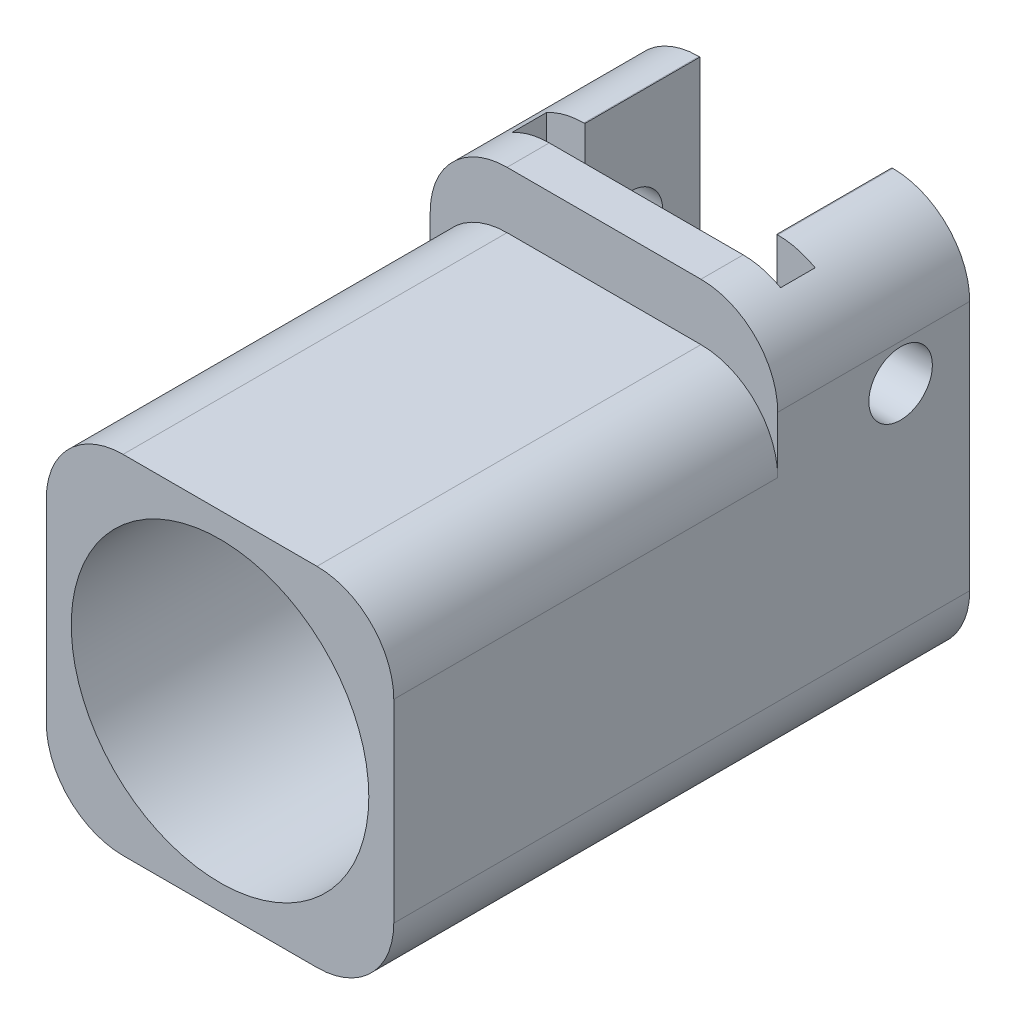
from build123d import *

# Parameters (mm, degrees)
BOSS_EXTRUDE1_DEPTH = 30
BOSS_EXTRUDE3_DEPTH = 10
SKETCH17_R          = 1.655
CUT_EXTRUDE10_DEPTH = 30
CUT_EXTRUDE11_DEPTH = 6
CUT_EXTRUDE12_DEPTH = 1.8
CUT_EXTRUDE13_DEPTH = 7.2
SKETCH24_R          = 7.75
CUT_EXTRUDE15_DEPTH = 19


with BuildPart() as part:
    # Sketch1 → Boss-Extrude1 (new body)
    with BuildSketch(Plane.XY):
        with BuildLine():
            Line((-5.05, 9.05), (5.05, 9.05))
            ThreePointArc((5.05, 9.05), (7.878427125, 7.878427125), (9.05, 5.05))
            Line((9.05, 5.05), (9.05, -5.05))
            ThreePointArc((9.05, -5.05), (7.878427125, -7.878427125), (5.05, -9.05))
            Line((5.05, -9.05), (-5.05, -9.05))
            ThreePointArc((-5.05, -9.05), (-7.878427125, -7.878427125), (-9.05, -5.05))
            Line((-9.05, -5.05), (-9.05, 5.05))
            ThreePointArc((-9.05, 5.05), (-7.878427125, 7.878427125), (-5.05, 9.05))
        make_face()
    extrude(amount=BOSS_EXTRUDE1_DEPTH)

    # Sketch15 → Boss-Extrude3 (add)
    with BuildSketch(Plane.XY):
        with BuildLine():
            Line((-5.05, -9.05), (5.05, -9.05))
            ThreePointArc((5.05, -9.05), (7.878427125, -7.878427125), (9.05, -5.05))
            Line((9.05, -5.05), (9.05, 8))
            ThreePointArc((9.05, 8), (7.878427125, 10.828427125), (5.05, 12))
            Line((5.05, 12), (-5.05, 12))
            ThreePointArc((-5.05, 12), (-7.878427125, 10.828427125), (-9.05, 8))
            Line((-9.05, 8), (-9.05, -5.05))
            ThreePointArc((-9.05, -5.05), (-7.878427125, -7.878427125), (-5.05, -9.05))
        make_face()
    extrude(amount=BOSS_EXTRUDE3_DEPTH)

    # Sketch17 → Cut-Extrude10 (cut)
    with BuildSketch(Plane(origin=(9.05, 0, 0), x_dir=(0, 0, -1), z_dir=(1, 0, 0))):
        with Locations((-3.6, 6.1)):
            Circle(SKETCH17_R)
    extrude(amount=-CUT_EXTRUDE10_DEPTH, mode=Mode.SUBTRACT)

    # Sketch18 → Cut-Extrude11 (cut)
    with BuildSketch(Plane.XY):
        Polygon((-4.996539756, -4.259182236), (-3.851088562, -6.946129507), (-2.048481088, -4.559068161), (-0.563070773, -7.21717083), (0.983895836, -4.624244345), (2.704822485, -7.21717083), (3.469678774, -4.870091009), (4.674482161, -7.026054964), (4.998172504, -5.668676456), (4.998172504, 5.373520003), (-4.996539756, 5.373520003), align=None)
    extrude(amount=CUT_EXTRUDE11_DEPTH, mode=Mode.SUBTRACT)

    # Sketch20 → Cut-Extrude12 (cut)
    with BuildSketch(Plane(origin=(0, 0, 6), x_dir=(-1, 0, 0), z_dir=(0, 0, -1))):
        Polygon((-7, 0), (-7, 13.473809321), (7, 13.473809321), (7, 0), (7, -7.194424303), (-7, -7.194424303), align=None)
    extrude(amount=-CUT_EXTRUDE12_DEPTH, mode=Mode.SUBTRACT)

    # Sketch21 → Cut-Extrude13 (cut)
    with BuildSketch(Plane.XY):
        Polygon((5, 17.493725323), (-5, 17.493725323), (-5, 0), (-5, -0.5), (5, -0.5), (5, 0), align=None)
    extrude(amount=CUT_EXTRUDE13_DEPTH, mode=Mode.SUBTRACT)

    # Sketch24 → Cut-Extrude15 (cut)
    with BuildSketch(Plane.XY.offset(30)):
        Circle(SKETCH24_R)
    extrude(amount=-CUT_EXTRUDE15_DEPTH, mode=Mode.SUBTRACT)


solid = part.part
